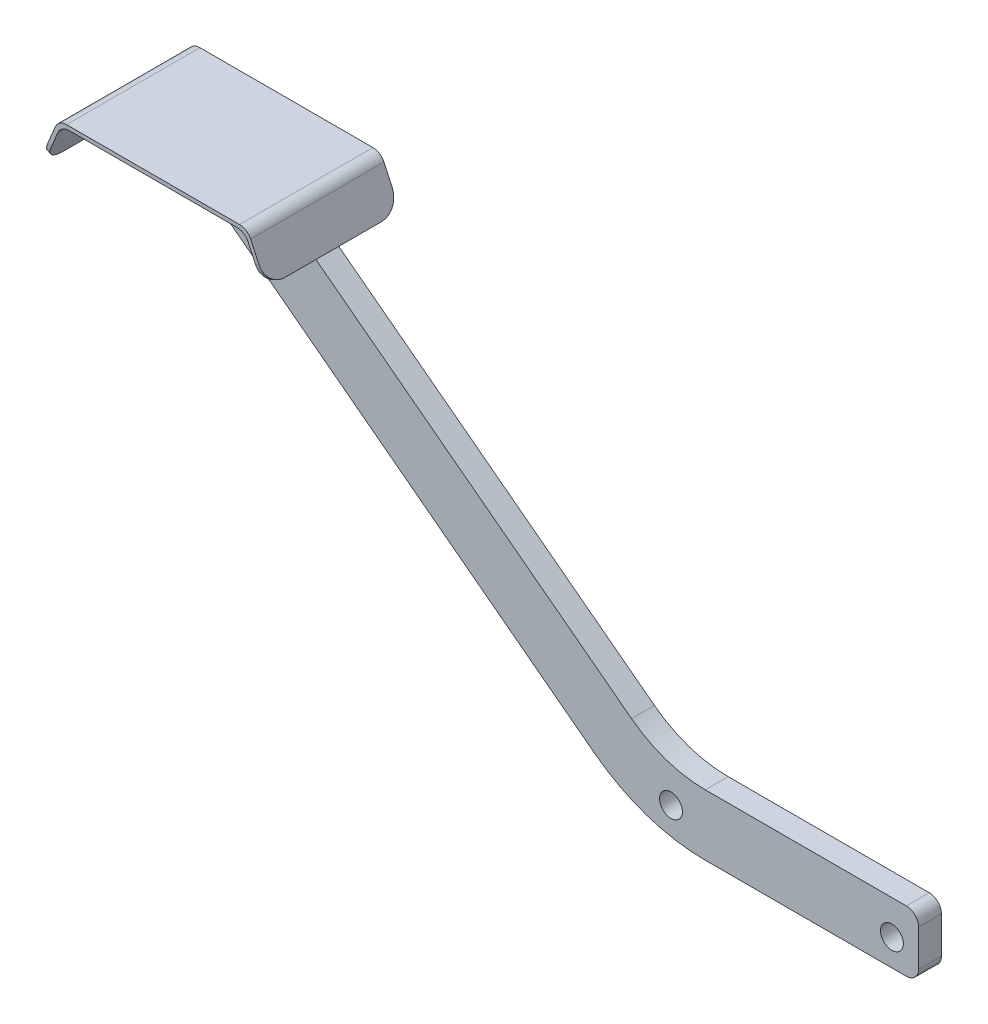
from build123d import *

# Parameters (mm, degrees)
BOSS_EXTRUDE1_DEPTH = 9.525
FILLET1_R           = 5.08
SKETCH2_R           = 4.7625
CUT_EXTRUDE1_DEPTH  = 246.132570215
BOSS_EXTRUDE2_DEPTH = 27.78125
FILLET2_R           = 5.08
FILLET3_R           = 7.62


with BuildPart() as part:
    # Sketch1 → Boss-Extrude1 (new body)
    with BuildSketch(Plane.XY):
        with BuildLine():
            Line((126.383881188, 0), (37.483881188, 0))
            ThreePointArc((37.483881188, 0), (13.166369807, 3.984360141), (-8.608104223, 15.520770598))
            Line((-8.608104223, 15.520770598), (-190.64579243, 153.796726831))
            Line((-190.64579243, 153.796726831), (-148.654110302, 153.796726831))
            Line((-148.654110302, 153.796726831), (6.755890914, 35.747180398))
            ThreePointArc((6.755890914, 35.747180398), (21.272206934, 28.056240094), (37.483881188, 25.4))
            Line((37.483881188, 25.4), (126.383881188, 25.4))
            Line((126.383881188, 25.4), (126.383881188, 0))
        make_face()
    extrude(amount=-BOSS_EXTRUDE1_DEPTH)

    # Fillet1
    fillet1_edges = [part.edges().sort_by_distance(p)[0] for p in [
        (126.383881188, 0, -4.7625),
        (126.383881188, 25.4, -4.7625),
    ]]
    fillet(fillet1_edges, radius=FILLET1_R)

    # Sketch2 → Cut-Extrude1 (cut, through all)
    with BuildSketch(Plane.XY):
        with Locations((115.271381188, 11.1125)):
            Circle(SKETCH2_R)
        with Locations((23.196381188, 12.7)):
            Circle(SKETCH2_R)
    extrude(amount=-CUT_EXTRUDE1_DEPTH, mode=Mode.SUBTRACT)

    # Sketch3 → Boss-Extrude2 (add, symmetric)
    with BuildSketch(Plane.XY.offset(-4.7625)):
        Polygon((-190.64579243, 153.796726831), (-148.654110302, 153.796726831), (-131.319590281, 153.796726831), (-123.747576859, 137.428026377), (-122.306768887, 138.09453117), (-130.304826398, 155.384226831), (-148.654110302, 155.384226831), (-190.64579243, 155.384226831), (-209.037615115, 155.384226831), (-216.380347625, 137.806207053), (-214.915512644, 137.194312678), (-207.980312451, 153.796726831), align=None)
    extrude(amount=BOSS_EXTRUDE2_DEPTH, both=True)

    # Fillet2
    fillet2_edges = [part.edges().sort_by_distance(p)[0] for p in [
        (-207.980312451, 153.796726831, -4.7625),
        (-131.319590281, 153.796726831, -4.7625),
        (-130.304826398, 155.384226831, -4.7625),
        (-209.037615115, 155.384226831, -4.7625),
    ]]
    fillet(fillet2_edges, radius=FILLET2_R)

    # Fillet3
    fillet3_edges = [part.edges().sort_by_distance(p)[0] for p in [
        (-123.027172873, 137.761278773, -32.54375),
        (-215.647930134, 137.500259865, -32.54375),
        (-123.027172873, 137.761278773, 23.01875),
        (-215.647930134, 137.500259865, 23.01875),
    ]]
    fillet(fillet3_edges, radius=FILLET3_R)


solid = part.part
